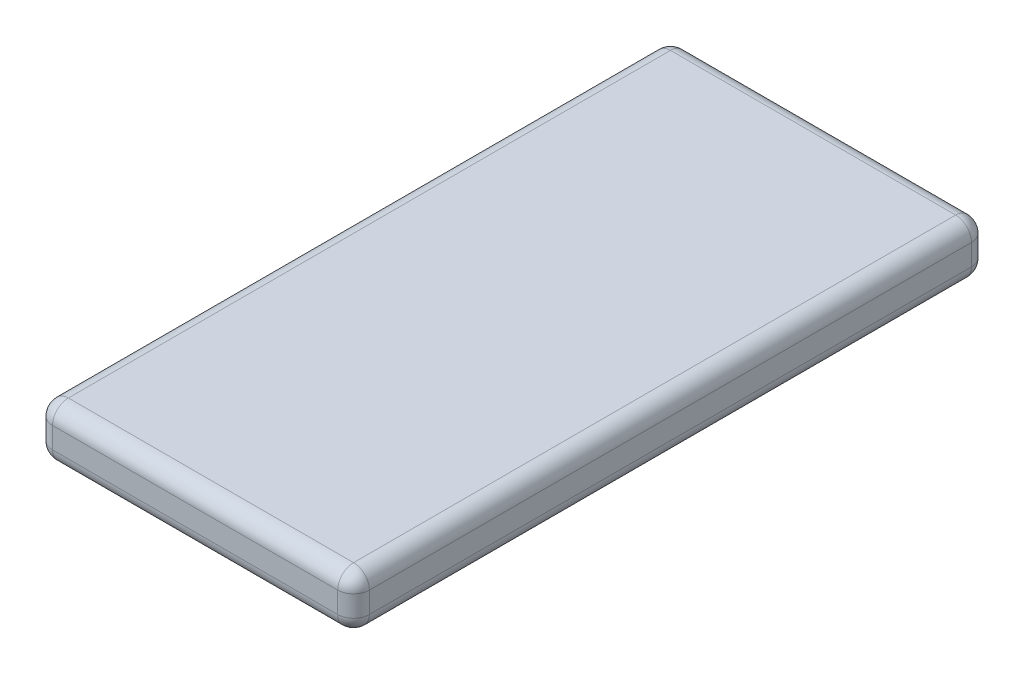
from build123d import *

# Parameters (mm, degrees)
SKETCH2_W           = 600
SKETCH2_H           = 1200
BOSS_EXTRUDE1_DEPTH = 100
FILLET1_R           = 30


with BuildPart() as part:
    # Sketch2 → Boss-Extrude1 (new body)
    with BuildSketch(Plane(origin=(0, 0, 0), x_dir=(1, 0, 0), z_dir=(0, 1, 0))):
        Rectangle(SKETCH2_W, SKETCH2_H)
    extrude(amount=BOSS_EXTRUDE1_DEPTH)

    # Fillet1
    fillet1_edges = [part.edges().sort_by_distance(p)[0] for p in [
        (300, 100, 0),
        (0, 100, -600),
        (-300, 100, 0),
        (0, 0, -600),
        (300, 0, 0),
        (0, 0, 600),
        (-300, 0, 0),
        (-300, 50, -600),
        (300, 50, -600),
        (300, 50, 600),
        (-300, 50, 600),
        (0, 100, 600),
    ]]
    fillet(fillet1_edges, radius=FILLET1_R)


solid = part.part
